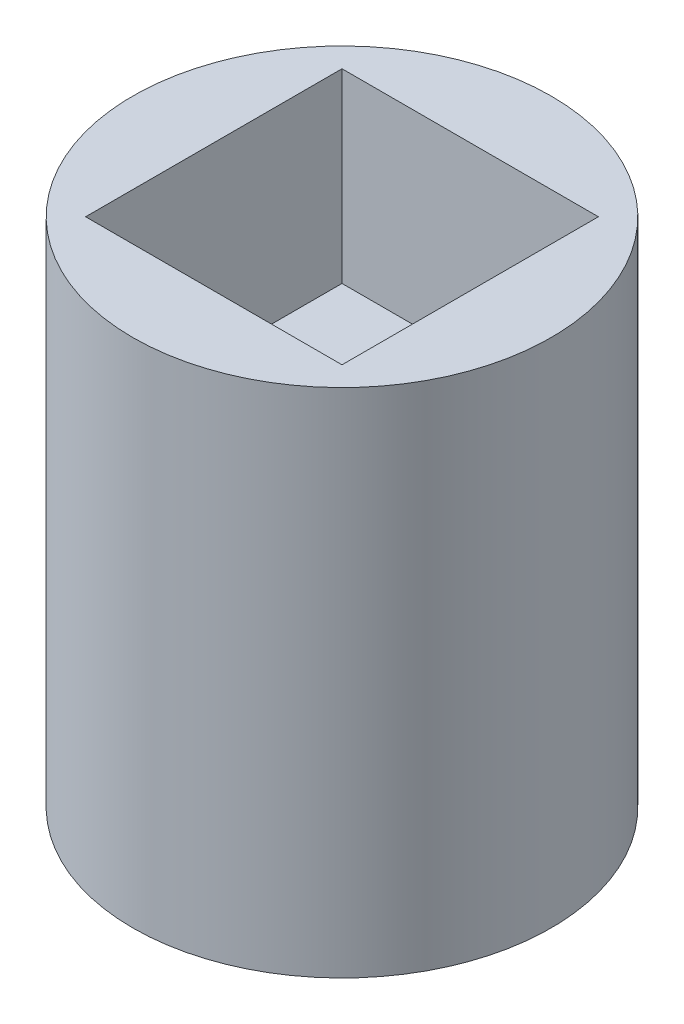
from build123d import *

# Parameters (mm, degrees)
ESQUISSE1_R             = 11.25
BOSS_EXTRU_1_DEPTH      = 13.75
ESQUISSE3_W             = 13.788582234
ESQUISSE3_H             = 13.788582234
ENL_V_MAT_EXTRU_3_DEPTH = 10


with BuildPart() as part:
    # Esquisse1 → Boss.-Extru.1 (new, symmetric)
    with BuildSketch(Plane(origin=(0, 0, 0), x_dir=(1, 0, 0), z_dir=(0, 1, 0))):
        with Locations(Location((0, 0, 0), (0, 0, 270))):
            Circle(ESQUISSE1_R)
    extrude(amount=BOSS_EXTRU_1_DEPTH, both=True)

    # Esquisse3 → Enlèv. mat.-Extru.3 (cut)
    with BuildSketch(Plane(origin=(0, 13.75, 0), x_dir=(1, 0, 0), z_dir=(0, 1, 0))):
        Rectangle(ESQUISSE3_W, ESQUISSE3_H)
    enl_v_mat_extru_3 = extrude(amount=-ENL_V_MAT_EXTRU_3_DEPTH, mode=Mode.SUBTRACT)

    # Symétrie1: Enlèv. mat.-Extru.3 across plane
    add(enl_v_mat_extru_3.mirror(Plane.ZX), mode=Mode.SUBTRACT)


solid = part.part
